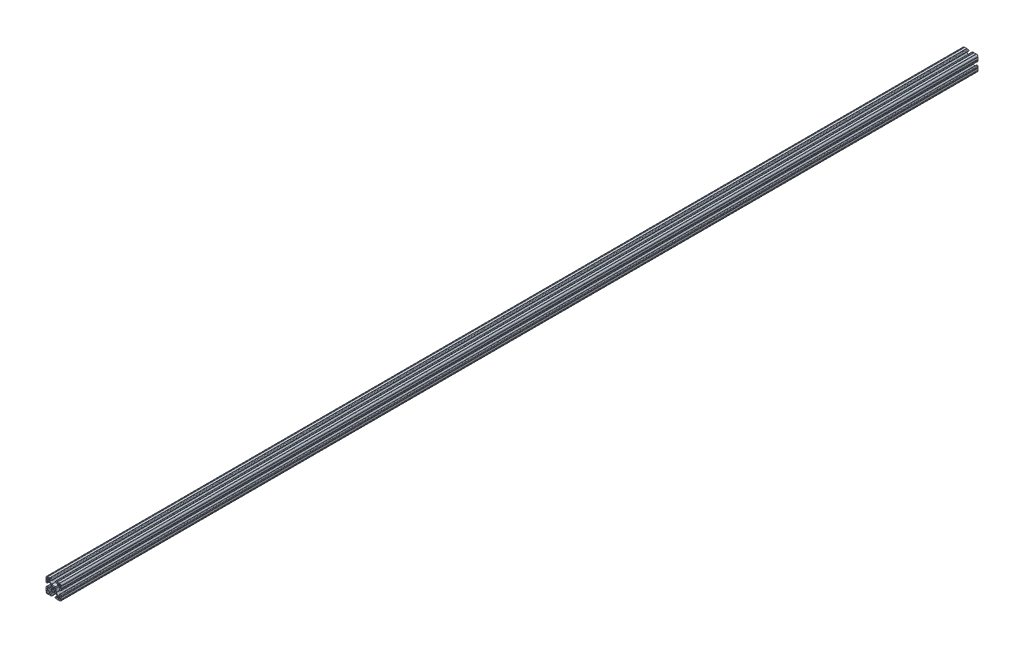
from build123d import *

# Parameters (mm, degrees)
BOSS_EXTRUDE1_DEPTH = 2322.576


with BuildPart() as part:
    # Sketch1 → Boss-Extrude1 (new body)
    with BuildSketch(Plane(origin=(0, 0, -2322.576), x_dir=(-1, 0, 0), z_dir=(0, 0, -1))):
        with BuildLine():
            Line((19.05, -14.325600033), (19.05, -9.4996))
            ThreePointArc((19.05, -9.4996), (18.288, -8.7376), (19.05, -7.9756))
            Line((19.05, -7.9756), (19.05, -5.6388))
            ThreePointArc((19.05, -5.6388), (18.588751759, -4.525248241), (17.4752, -4.064))
            Line((17.4752, -4.064), (16.5608, -4.064))
            ThreePointArc((16.5608, -4.064), (15.447248241, -4.525248241), (14.986, -5.6388))
            Line((14.986, -5.6388), (14.986, -6.350014224))
            ThreePointArc((14.986, -6.350014224), (15.097592316, -6.619421908), (15.367, -6.731014224))
            Line((15.367, -6.731014224), (15.6972, -6.731014224))
            ThreePointArc((15.6972, -6.731014224), (15.966607684, -6.84260654), (16.0782, -7.112014224))
            Line((16.0782, -7.112014224), (16.0782, -9.398014224))
            ThreePointArc((16.0782, -9.398014224), (15.817817928, -10.026632152), (15.1892, -10.287014224))
            Line((15.1892, -10.287014224), (12.375630013, -10.287014224))
            ThreePointArc((12.375630013, -10.287014224), (11.889622054, -10.19034123), (11.477604401, -9.915039836))
            Line((11.477604401, -9.915039836), (7.115699788, -5.553135223))
            ThreePointArc((7.115699788, -5.553135223), (6.840398394, -5.14111757), (6.7437254, -4.655109611))
            Line((6.7437254, -4.655109611), (6.7437254, 4.655109611))
            ThreePointArc((6.7437254, 4.655109611), (6.840398394, 5.14111757), (7.115699788, 5.553135223))
            Line((7.115699788, 5.553135223), (11.477604401, 9.915039836))
            ThreePointArc((11.477604401, 9.915039836), (11.889622054, 10.19034123), (12.375630013, 10.287014224))
            Line((12.375630013, 10.287014224), (15.1892, 10.287014224))
            ThreePointArc((15.1892, 10.287014224), (15.817817928, 10.026632152), (16.0782, 9.398014224))
            Line((16.0782, 9.398014224), (16.0782, 7.112014224))
            ThreePointArc((16.0782, 7.112014224), (15.966607684, 6.84260654), (15.6972, 6.731014224))
            Line((15.6972, 6.731014224), (15.367, 6.731014224))
            ThreePointArc((15.367, 6.731014224), (15.097592316, 6.619421908), (14.986, 6.350014224))
            Line((14.986, 6.350014224), (14.986, 5.6388))
            ThreePointArc((14.986, 5.6388), (15.447248241, 4.525248241), (16.5608, 4.064))
            Line((16.5608, 4.064), (17.4752, 4.064))
            ThreePointArc((17.4752, 4.064), (18.588751759, 4.525248241), (19.05, 5.6388))
            Line((19.05, 5.6388), (19.05, 7.9756))
            ThreePointArc((19.05, 7.9756), (18.288, 8.7376), (19.05, 9.4996))
            Line((19.05, 9.4996), (19.05, 14.325599984))
            ThreePointArc((19.05, 14.325599984), (18.287999986, 15.087549208), (19.049898416, 15.849600009))
            ThreePointArc((19.049898416, 15.849600009), (18.120064036, 18.120064058), (15.849599977, 19.049898414))
            ThreePointArc((15.849599977, 19.049898414), (15.0875492, 18.288000035), (14.325600017, 19.050000016))
            Line((14.325600017, 19.050000016), (9.499600001, 19.050000016))
            ThreePointArc((9.499600001, 19.050000016), (8.737600001, 18.288000016), (7.975600001, 19.050000016))
            Line((7.975600001, 19.050000016), (5.638800016, 19.050000016))
            ThreePointArc((5.638800016, 19.050000016), (4.525248257, 18.588751775), (4.064000016, 17.475200016))
            Line((4.064000016, 17.475200016), (4.064000016, 16.5608))
            ThreePointArc((4.064000016, 16.5608), (4.525248257, 15.447248241), (5.638800016, 14.986))
            Line((5.638800016, 14.986), (6.350014224, 14.986))
            ThreePointArc((6.350014224, 14.986), (6.619421908, 15.097592316), (6.731014224, 15.367))
            Line((6.731014224, 15.367), (6.731014224, 15.6972))
            ThreePointArc((6.731014224, 15.6972), (6.84260654, 15.966607684), (7.112014224, 16.0782))
            Line((7.112014224, 16.0782), (9.398014224, 16.0782))
            ThreePointArc((9.398014224, 16.0782), (10.026632152, 15.817817928), (10.287014224, 15.1892))
            Line((10.287014224, 15.1892), (10.287014224, 12.375630013))
            ThreePointArc((10.287014224, 12.375630013), (10.19034123, 11.889622054), (9.915039836, 11.477604401))
            Line((9.915039836, 11.477604401), (5.553135223, 7.115699788))
            ThreePointArc((5.553135223, 7.115699788), (5.14111757, 6.840398394), (4.655109611, 6.7437254))
            Line((4.655109611, 6.7437254), (-4.655109611, 6.7437254))
            ThreePointArc((-4.655109611, 6.7437254), (-5.14111757, 6.840398394), (-5.553135223, 7.115699788))
            Line((-5.553135223, 7.115699788), (-9.915039836, 11.477604401))
            ThreePointArc((-9.915039836, 11.477604401), (-10.19034123, 11.889622054), (-10.287014224, 12.375630013))
            Line((-10.287014224, 12.375630013), (-10.287014224, 15.1892))
            ThreePointArc((-10.287014224, 15.1892), (-10.026632152, 15.817817928), (-9.398014224, 16.0782))
            Line((-9.398014224, 16.0782), (-7.112014224, 16.0782))
            ThreePointArc((-7.112014224, 16.0782), (-6.84260654, 15.966607684), (-6.731014224, 15.6972))
            Line((-6.731014224, 15.6972), (-6.731014224, 15.367))
            ThreePointArc((-6.731014224, 15.367), (-6.619421908, 15.097592316), (-6.350014224, 14.986))
            Line((-6.350014224, 14.986), (-5.638799984, 14.986))
            ThreePointArc((-5.638799984, 14.986), (-4.525248225, 15.447248241), (-4.063999984, 16.5608))
            Line((-4.063999984, 16.5608), (-4.063999984, 17.475200016))
            ThreePointArc((-4.063999984, 17.475200016), (-4.525248225, 18.588751775), (-5.638799984, 19.050000016))
            Line((-5.638799984, 19.050000016), (-7.975599999, 19.050000016))
            ThreePointArc((-7.975599999, 19.050000016), (-8.737599999, 18.288000016), (-9.499599999, 19.050000016))
            Line((-9.499599999, 19.050000016), (-14.325599999, 19.050000016))
            ThreePointArc((-14.325599999, 19.050000016), (-15.087549199, 18.288000018), (-15.849599993, 19.049898416))
            ThreePointArc((-15.849599993, 19.049898416), (-18.120064042, 18.120064036), (-19.049898398, 15.849599976))
            ThreePointArc((-19.049898398, 15.849599976), (-18.288000019, 15.087549199), (-19.05, 14.325600017))
            Line((-19.05, 14.325600017), (-19.05, 9.4996))
            ThreePointArc((-19.05, 9.4996), (-18.288, 8.7376), (-19.05, 7.9756))
            Line((-19.05, 7.9756), (-19.05, 5.6388))
            ThreePointArc((-19.05, 5.6388), (-18.588751759, 4.525248241), (-17.4752, 4.064))
            Line((-17.4752, 4.064), (-16.5608, 4.064))
            ThreePointArc((-16.5608, 4.064), (-15.447248241, 4.525248241), (-14.986, 5.6388))
            Line((-14.986, 5.6388), (-14.986, 6.350014224))
            ThreePointArc((-14.986, 6.350014224), (-15.097592316, 6.619421908), (-15.367, 6.731014224))
            Line((-15.367, 6.731014224), (-15.6972, 6.731014224))
            ThreePointArc((-15.6972, 6.731014224), (-15.966607684, 6.84260654), (-16.0782, 7.112014224))
            Line((-16.0782, 7.112014224), (-16.0782, 9.398014224))
            ThreePointArc((-16.0782, 9.398014224), (-15.817817928, 10.026632152), (-15.1892, 10.287014224))
            Line((-15.1892, 10.287014224), (-12.375630013, 10.287014224))
            ThreePointArc((-12.375630013, 10.287014224), (-11.889622054, 10.19034123), (-11.477604401, 9.915039836))
            Line((-11.477604401, 9.915039836), (-7.115699788, 5.553135223))
            ThreePointArc((-7.115699788, 5.553135223), (-6.840398394, 5.14111757), (-6.7437254, 4.655109611))
            Line((-6.7437254, 4.655109611), (-6.7437254, -4.655109611))
            ThreePointArc((-6.7437254, -4.655109611), (-6.840398394, -5.14111757), (-7.115699788, -5.553135223))
            Line((-7.115699788, -5.553135223), (-11.477604401, -9.915039836))
            ThreePointArc((-11.477604401, -9.915039836), (-11.889622054, -10.19034123), (-12.375630013, -10.287014224))
            Line((-12.375630013, -10.287014224), (-15.1892, -10.287014224))
            ThreePointArc((-15.1892, -10.287014224), (-15.817817928, -10.026632152), (-16.0782, -9.398014224))
            Line((-16.0782, -9.398014224), (-16.0782, -7.112014224))
            ThreePointArc((-16.0782, -7.112014224), (-15.966607684, -6.84260654), (-15.6972, -6.731014224))
            Line((-15.6972, -6.731014224), (-15.367, -6.731014224))
            ThreePointArc((-15.367, -6.731014224), (-15.097592316, -6.619421908), (-14.986, -6.350014224))
            Line((-14.986, -6.350014224), (-14.986, -5.6388))
            ThreePointArc((-14.986, -5.6388), (-15.447248241, -4.525248241), (-16.5608, -4.064))
            Line((-16.5608, -4.064), (-17.4752, -4.064))
            ThreePointArc((-17.4752, -4.064), (-18.588751759, -4.525248241), (-19.05, -5.6388))
            Line((-19.05, -5.6388), (-19.05, -7.9756))
            ThreePointArc((-19.05, -7.9756), (-18.288, -8.7376), (-19.05, -9.4996))
            Line((-19.05, -9.4996), (-19.05, -14.3256))
            ThreePointArc((-19.05, -14.3256), (-18.288000002, -15.0875492), (-19.0498984, -15.849599993))
            ThreePointArc((-19.0498984, -15.849599993), (-18.120064019, -18.120064043), (-15.84959996, -19.049898399))
            ThreePointArc((-15.84959996, -19.049898399), (-15.087549183, -18.288000019), (-14.325600001, -19.050000001))
            Line((-14.325600001, -19.050000001), (-9.499599984, -19.050000001))
            ThreePointArc((-9.499599984, -19.050000001), (-8.737599984, -18.288000001), (-7.975599984, -19.050000001))
            Line((-7.975599984, -19.050000001), (-5.638799984, -19.050000001))
            ThreePointArc((-5.638799984, -19.050000001), (-4.525248225, -18.58875176), (-4.063999984, -17.475200001))
            Line((-4.063999984, -17.475200001), (-4.063999984, -16.5608))
            ThreePointArc((-4.063999984, -16.5608), (-4.525248225, -15.447248241), (-5.638799984, -14.986))
            Line((-5.638799984, -14.986), (-6.350014224, -14.986))
            ThreePointArc((-6.350014224, -14.986), (-6.619421908, -15.097592316), (-6.731014224, -15.367))
            Line((-6.731014224, -15.367), (-6.731014224, -15.6972))
            ThreePointArc((-6.731014224, -15.6972), (-6.84260654, -15.966607684), (-7.112014224, -16.0782))
            Line((-7.112014224, -16.0782), (-9.398014224, -16.0782))
            ThreePointArc((-9.398014224, -16.0782), (-10.026632152, -15.817817928), (-10.287014224, -15.1892))
            Line((-10.287014224, -15.1892), (-10.287014224, -12.375630013))
            ThreePointArc((-10.287014224, -12.375630013), (-10.19034123, -11.889622054), (-9.915039836, -11.477604401))
            Line((-9.915039836, -11.477604401), (-5.553135223, -7.115699788))
            ThreePointArc((-5.553135223, -7.115699788), (-5.14111757, -6.840398394), (-4.655109611, -6.7437254))
            Line((-4.655109611, -6.7437254), (4.655109611, -6.7437254))
            ThreePointArc((4.655109611, -6.7437254), (5.14111757, -6.840398394), (5.553135223, -7.115699788))
            Line((5.553135223, -7.115699788), (9.915039836, -11.477604401))
            ThreePointArc((9.915039836, -11.477604401), (10.19034123, -11.889622054), (10.287014224, -12.375630013))
            Line((10.287014224, -12.375630013), (10.287014224, -15.1892))
            ThreePointArc((10.287014224, -15.1892), (10.026632152, -15.817817928), (9.398014224, -16.0782))
            Line((9.398014224, -16.0782), (7.112014224, -16.0782))
            ThreePointArc((7.112014224, -16.0782), (6.84260654, -15.966607684), (6.731014224, -15.6972))
            Line((6.731014224, -15.6972), (6.731014224, -15.367))
            ThreePointArc((6.731014224, -15.367), (6.619421908, -15.097592316), (6.350014224, -14.986))
            Line((6.350014224, -14.986), (5.638800016, -14.986))
            ThreePointArc((5.638800016, -14.986), (4.525248257, -15.447248241), (4.064000016, -16.5608))
            Line((4.064000016, -16.5608), (4.064000016, -17.475200001))
            ThreePointArc((4.064000016, -17.475200001), (4.525248257, -18.58875176), (5.638800016, -19.050000001))
            Line((5.638800016, -19.050000001), (7.975600016, -19.050000001))
            ThreePointArc((7.975600016, -19.050000001), (8.737600016, -18.288000001), (9.499600016, -19.050000001))
            Line((9.499600016, -19.050000001), (14.325600016, -19.050000001))
            ThreePointArc((14.325600016, -19.050000001), (15.087549216, -18.288000002), (15.849600009, -19.0498984))
            ThreePointArc((15.849600009, -19.0498984), (18.120064059, -18.12006402), (19.049898415, -15.849599961))
            ThreePointArc((19.049898415, -15.849599961), (18.288000034, -15.087549207), (19.05, -14.325600033))
        make_face()
        with BuildLine():
            Line((17.246614224, 14.452614224), (17.246614224, 12.242814224))
            ThreePointArc((17.246614224, 12.242814224), (17.135021908, 11.97340654), (16.865614224, 11.861814224))
            Line((16.865614224, 11.861814224), (15.092694224, 11.861814224))
            Line((15.092694224, 11.861814224), (14.554214224, 12.400294224))
            Line((14.554214224, 12.400294224), (14.015734224, 11.861814224))
            Line((14.015734224, 11.861814224), (12.242814224, 11.861814224))
            ThreePointArc((12.242814224, 11.861814224), (11.97340654, 11.97340654), (11.861814224, 12.242814224))
            Line((11.861814224, 12.242814224), (11.861814224, 14.015734224))
            Line((11.861814224, 14.015734224), (12.400294224, 14.554214224))
            Line((12.400294224, 14.554214224), (11.861814224, 15.092694224))
            Line((11.861814224, 15.092694224), (11.861814224, 16.865614224))
            ThreePointArc((11.861814224, 16.865614224), (11.97340654, 17.135021908), (12.242814224, 17.246614224))
            Line((12.242814224, 17.246614224), (14.452614224, 17.246614224))
            ThreePointArc((14.452614224, 17.246614224), (16.428270571, 16.428270571), (17.246614224, 14.452614224))
        make_face(mode=Mode.SUBTRACT)
        with BuildLine():
            Line((17.246614224, -12.242814224), (17.246614224, -14.452614224))
            ThreePointArc((17.246614224, -14.452614224), (16.428270571, -16.428270571), (14.452614224, -17.246614224))
            Line((14.452614224, -17.246614224), (12.242814224, -17.246614224))
            ThreePointArc((12.242814224, -17.246614224), (11.97340654, -17.135021908), (11.861814224, -16.865614224))
            Line((11.861814224, -16.865614224), (11.861814224, -15.092694224))
            Line((11.861814224, -15.092694224), (12.400294224, -14.554214224))
            Line((12.400294224, -14.554214224), (11.861814224, -14.015734224))
            Line((11.861814224, -14.015734224), (11.861814224, -12.242814224))
            ThreePointArc((11.861814224, -12.242814224), (11.97340654, -11.97340654), (12.242814224, -11.861814224))
            Line((12.242814224, -11.861814224), (14.015734224, -11.861814224))
            Line((14.015734224, -11.861814224), (14.554214224, -12.400294224))
            Line((14.554214224, -12.400294224), (15.092694224, -11.861814224))
            Line((15.092694224, -11.861814224), (16.865614224, -11.861814224))
            ThreePointArc((16.865614224, -11.861814224), (17.135021908, -11.97340654), (17.246614224, -12.242814224))
        make_face(mode=Mode.SUBTRACT)
        with BuildLine():
            Line((5.1689, -3.920689755), (5.1689, -4.9149))
            ThreePointArc((5.1689, -4.9149), (5.094505122, -5.094505122), (4.9149, -5.1689))
            Line((4.9149, -5.1689), (3.920689755, -5.1689))
            ThreePointArc((3.920689755, -5.1689), (3.580484184, -5.101228904), (3.292071827, -4.908517928))
            Line((3.292071827, -4.908517928), (1.582347442, -3.198793543))
            ThreePointArc((1.582347442, -3.198793543), (1.393016011, -3.095711236), (1.178048687, -3.111879183))
            ThreePointArc((1.178048687, -3.111879183), (0, -3.3274), (-1.178048687, -3.111879183))
            ThreePointArc((-1.178048687, -3.111879183), (-1.393016011, -3.095711236), (-1.582347442, -3.198793543))
            Line((-1.582347442, -3.198793543), (-3.292071827, -4.908517928))
            ThreePointArc((-3.292071827, -4.908517928), (-3.580484184, -5.101228904), (-3.920689755, -5.1689))
            Line((-3.920689755, -5.1689), (-4.9149, -5.1689))
            ThreePointArc((-4.9149, -5.1689), (-5.094505122, -5.094505122), (-5.1689, -4.9149))
            Line((-5.1689, -4.9149), (-5.1689, -3.920689755))
            ThreePointArc((-5.1689, -3.920689755), (-5.101228904, -3.580484184), (-4.908517928, -3.292071827))
            Line((-4.908517928, -3.292071827), (-3.198793543, -1.582347442))
            ThreePointArc((-3.198793543, -1.582347442), (-3.095711236, -1.393016011), (-3.111879183, -1.178048687))
            ThreePointArc((-3.111879183, -1.178048687), (-3.3274, 0), (-3.111879183, 1.178048687))
            ThreePointArc((-3.111879183, 1.178048687), (-3.095711236, 1.393016011), (-3.198793543, 1.582347442))
            Line((-3.198793543, 1.582347442), (-4.908517928, 3.292071827))
            ThreePointArc((-4.908517928, 3.292071827), (-5.101228904, 3.580484184), (-5.1689, 3.920689755))
            Line((-5.1689, 3.920689755), (-5.1689, 4.9149))
            ThreePointArc((-5.1689, 4.9149), (-5.094505122, 5.094505122), (-4.9149, 5.1689))
            Line((-4.9149, 5.1689), (-3.920689755, 5.1689))
            ThreePointArc((-3.920689755, 5.1689), (-3.580484184, 5.101228904), (-3.292071827, 4.908517928))
            Line((-3.292071827, 4.908517928), (-1.582347442, 3.198793543))
            ThreePointArc((-1.582347442, 3.198793543), (-1.393016011, 3.095711236), (-1.178048687, 3.111879183))
            ThreePointArc((-1.178048687, 3.111879183), (0, 3.3274), (1.178048687, 3.111879183))
            ThreePointArc((1.178048687, 3.111879183), (1.393016011, 3.095711236), (1.582347442, 3.198793543))
            Line((1.582347442, 3.198793543), (3.292071827, 4.908517928))
            ThreePointArc((3.292071827, 4.908517928), (3.580484184, 5.101228904), (3.920689755, 5.1689))
            Line((3.920689755, 5.1689), (4.9149, 5.1689))
            ThreePointArc((4.9149, 5.1689), (5.094505122, 5.094505122), (5.1689, 4.9149))
            Line((5.1689, 4.9149), (5.1689, 3.920689755))
            ThreePointArc((5.1689, 3.920689755), (5.101228904, 3.580484184), (4.908517928, 3.292071827))
            Line((4.908517928, 3.292071827), (3.198793543, 1.582347442))
            ThreePointArc((3.198793543, 1.582347442), (3.095711236, 1.393016011), (3.111879183, 1.178048687))
            ThreePointArc((3.111879183, 1.178048687), (3.3274, 0), (3.111879183, -1.178048687))
            ThreePointArc((3.111879183, -1.178048687), (3.095711236, -1.393016011), (3.198793543, -1.582347442))
            Line((3.198793543, -1.582347442), (4.908517928, -3.292071827))
            ThreePointArc((4.908517928, -3.292071827), (5.101228904, -3.580484184), (5.1689, -3.920689755))
        make_face(mode=Mode.SUBTRACT)
        with BuildLine():
            Line((-11.861814224, -12.242814224), (-11.861814224, -14.015734224))
            Line((-11.861814224, -14.015734224), (-12.400294224, -14.554214224))
            Line((-12.400294224, -14.554214224), (-11.861814224, -15.092694224))
            Line((-11.861814224, -15.092694224), (-11.861814224, -16.865614224))
            ThreePointArc((-11.861814224, -16.865614224), (-11.97340654, -17.135021908), (-12.242814224, -17.246614224))
            Line((-12.242814224, -17.246614224), (-14.452614224, -17.246614224))
            ThreePointArc((-14.452614224, -17.246614224), (-16.428270571, -16.428270571), (-17.246614224, -14.452614224))
            Line((-17.246614224, -14.452614224), (-17.246614224, -12.242814224))
            ThreePointArc((-17.246614224, -12.242814224), (-17.135021908, -11.97340654), (-16.865614224, -11.861814224))
            Line((-16.865614224, -11.861814224), (-15.092694224, -11.861814224))
            Line((-15.092694224, -11.861814224), (-14.554214224, -12.400294224))
            Line((-14.554214224, -12.400294224), (-14.015734224, -11.861814224))
            Line((-14.015734224, -11.861814224), (-12.242814224, -11.861814224))
            ThreePointArc((-12.242814224, -11.861814224), (-11.97340654, -11.97340654), (-11.861814224, -12.242814224))
        make_face(mode=Mode.SUBTRACT)
        with BuildLine():
            Line((-11.861814224, 16.865614224), (-11.861814224, 15.092694224))
            Line((-11.861814224, 15.092694224), (-12.400294224, 14.554214224))
            Line((-12.400294224, 14.554214224), (-11.861814224, 14.015734224))
            Line((-11.861814224, 14.015734224), (-11.861814224, 12.242814224))
            ThreePointArc((-11.861814224, 12.242814224), (-11.97340654, 11.97340654), (-12.242814224, 11.861814224))
            Line((-12.242814224, 11.861814224), (-14.015734224, 11.861814224))
            Line((-14.015734224, 11.861814224), (-14.554214224, 12.400294224))
            Line((-14.554214224, 12.400294224), (-15.092694224, 11.861814224))
            Line((-15.092694224, 11.861814224), (-16.865614224, 11.861814224))
            ThreePointArc((-16.865614224, 11.861814224), (-17.135021908, 11.97340654), (-17.246614224, 12.242814224))
            Line((-17.246614224, 12.242814224), (-17.246614224, 14.452614224))
            ThreePointArc((-17.246614224, 14.452614224), (-16.428270571, 16.428270571), (-14.452614224, 17.246614224))
            Line((-14.452614224, 17.246614224), (-12.242814224, 17.246614224))
            ThreePointArc((-12.242814224, 17.246614224), (-11.97340654, 17.135021908), (-11.861814224, 16.865614224))
        make_face(mode=Mode.SUBTRACT)
    extrude(amount=-BOSS_EXTRUDE1_DEPTH)


solid = part.part
